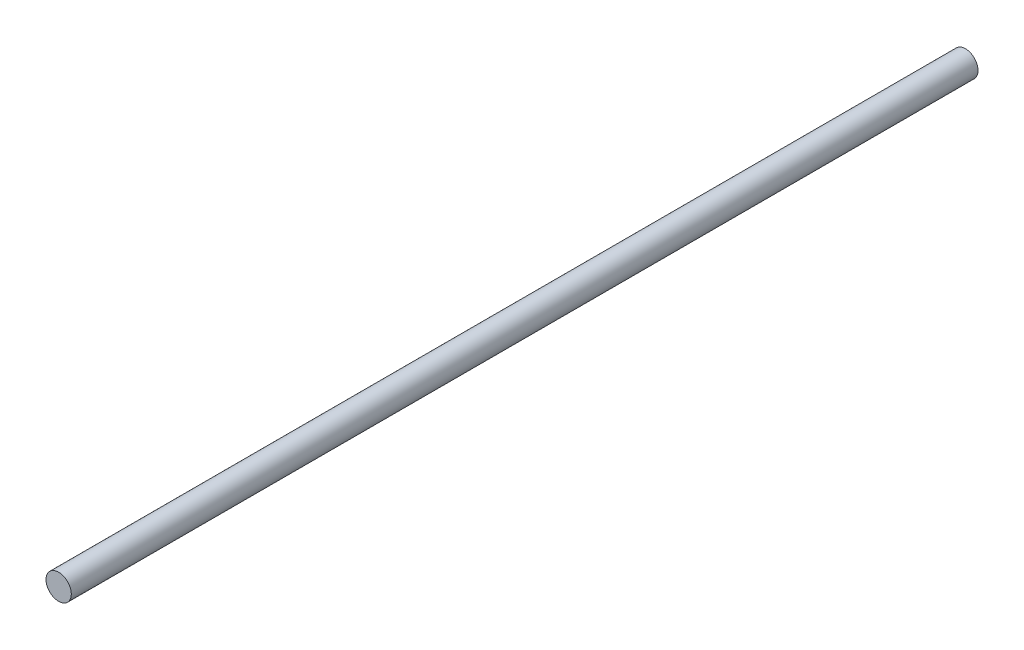
from build123d import *

# Parameters (mm, degrees)
SKETCH1_R           = 1.5
BOSS_EXTRUDE1_DEPTH = 107.6


with BuildPart() as part:
    # Sketch1 → Boss-Extrude1 (new body)
    with BuildSketch(Plane.XY):
        with Locations(Location((0, 0, 0), (0, 0, 180))):
            Circle(SKETCH1_R)
    extrude(amount=BOSS_EXTRUDE1_DEPTH)


solid = part.part
